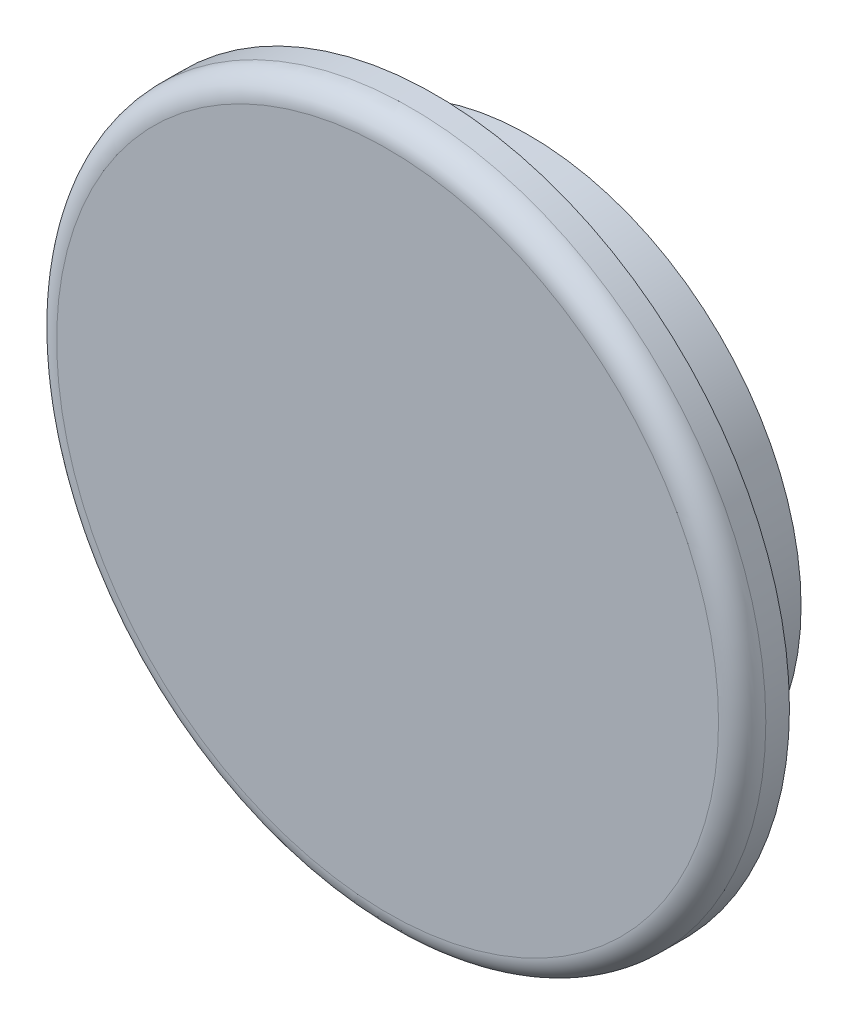
from build123d import *

# Parameters (mm, degrees)
SKETCH1_R           = 5.746
BOSS_EXTRUDE1_DEPTH = 2
SKETCH2_R           = 7.5
BOSS_EXTRUDE2_DEPTH = 1
FILLET1_R           = 0.5


with BuildPart() as part:
    # Sketch1 → Boss-Extrude1 (new body)
    with BuildSketch(Plane.XY):
        Circle(SKETCH1_R)
    extrude(amount=BOSS_EXTRUDE1_DEPTH)

    # Sketch2 → Boss-Extrude2 (add)
    with BuildSketch(Plane.XY.offset(2)):
        Circle(SKETCH2_R)
    extrude(amount=BOSS_EXTRUDE2_DEPTH)

    # Fillet1
    fillet1_edges = [part.edges().sort_by_distance(p)[0] for p in [
        (-7.5, 0, 3),
    ]]
    fillet(fillet1_edges, radius=FILLET1_R)


solid = part.part
